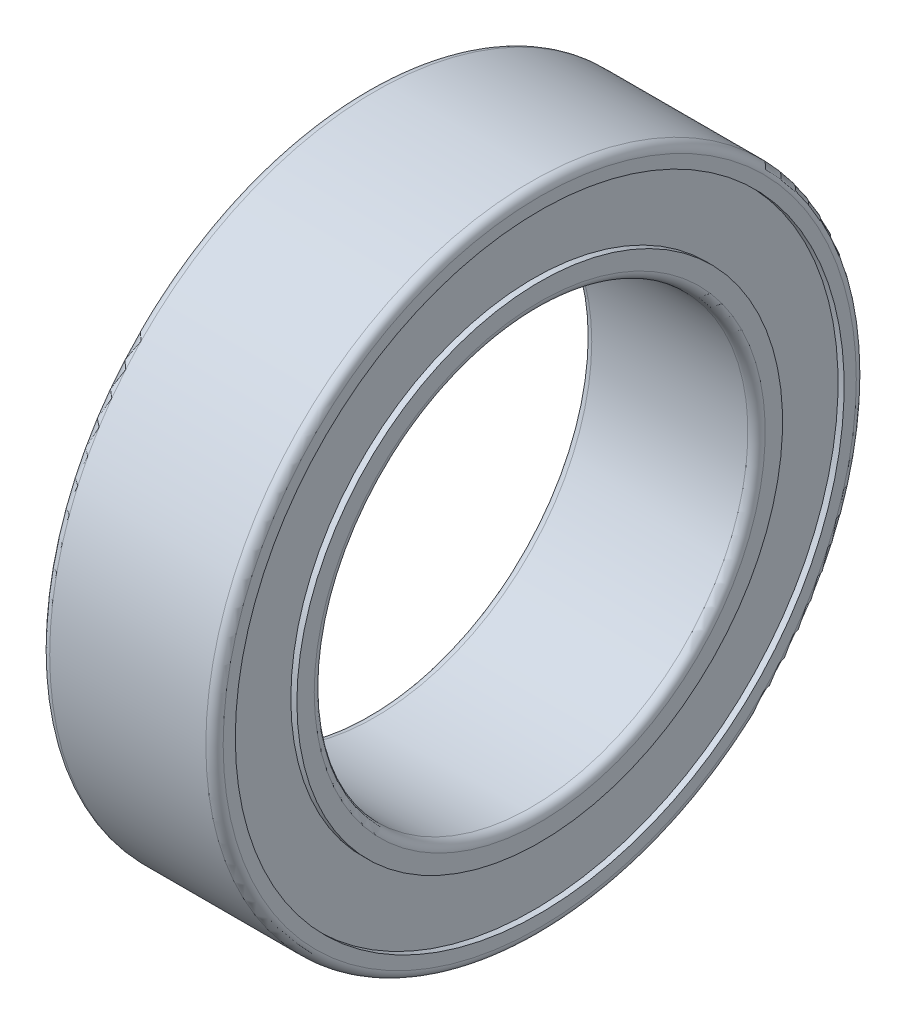
from build123d import *

# Parameters (mm, degrees)
FILLET1_R = 0.2
FILLET2_R = 0.2


with BuildPart() as part:
    # Sketch1 → Revolve1 (revolve)
    with BuildSketch(Plane.XY, mode=Mode.PRIVATE) as revolve1_sk:
        Polygon((0, 5), (4, 5), (4, 5.6), (3.86, 5.6), (3.86, 7.02), (4, 7.02), (4, 7.5), (0, 7.5), (0, 7.02), (0.14, 7.02), (0.14, 5.6), (0, 5.6), align=None)
    revolve(revolve1_sk.sketch.rotate(Axis((0, 0, 0), (1, 0, 0)), 90), axis=Axis((0, 0, 0), (1, 0, 0)))

    # Fillet1
    fillet1_edges = [part.edges().sort_by_distance(p)[0] for p in [
        (0, 0, -7.5),
        (4, 0, -7.5),
    ]]
    fillet(fillet1_edges, radius=FILLET1_R)

    # Fillet2
    fillet2_edges = [part.edges().sort_by_distance(p)[0] for p in [
        (4, 0, -5),
        (0, 0, -5),
    ]]
    fillet(fillet2_edges, radius=FILLET2_R)


solid = part.part
